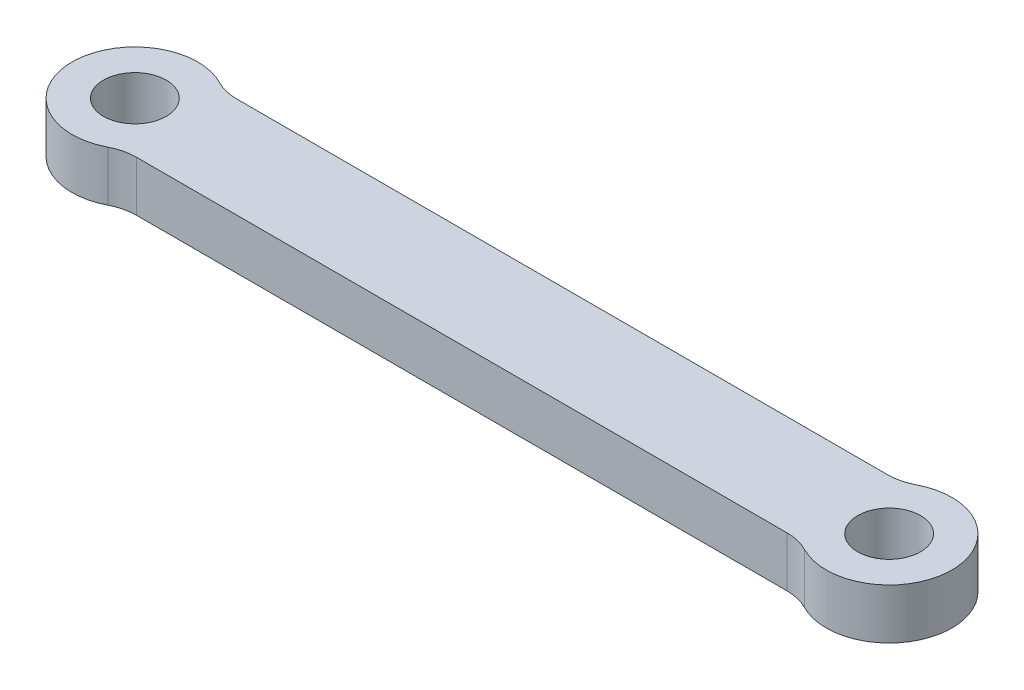
from build123d import *

# Parameters (mm, degrees)
SKETCH1_R           = 2.5
BOSS_EXTRUDE1_DEPTH = 2


with BuildPart() as part:
    # Sketch1 → Boss-Extrude1 (new, symmetric)
    with BuildSketch(Plane(origin=(0, 0, 0), x_dir=(1, 0, 0), z_dir=(0, 1, 0))):
        with BuildLine():
            Line((-25.876894374, 4), (25.876894374, 4))
            ThreePointArc((25.876894374, 4), (26.819703416, 4.112698737), (27.709385764, 4.444444444))
            ThreePointArc((27.709385764, 4.444444444), (35, 0), (27.709385764, -4.444444444))
            ThreePointArc((27.709385764, -4.444444444), (26.819703416, -4.112698737), (25.876894374, -4))
            Line((25.876894374, -4), (-25.876894374, -4))
            ThreePointArc((-25.876894374, -4), (-26.819703416, -4.112698737), (-27.709385764, -4.444444444))
            ThreePointArc((-27.709385764, -4.444444444), (-35, 0), (-27.709385764, 4.444444444))
            ThreePointArc((-27.709385764, 4.444444444), (-26.819703416, 4.112698737), (-25.876894374, 4))
        make_face()
        with Locations(Location((-30, 0, 0), (0, 0, 270))):
            Circle(SKETCH1_R, mode=Mode.SUBTRACT)
        with Locations(Location((30, 0, 0), (0, 0, 270))):
            Circle(SKETCH1_R, mode=Mode.SUBTRACT)
    extrude(amount=BOSS_EXTRUDE1_DEPTH, both=True)


solid = part.part
